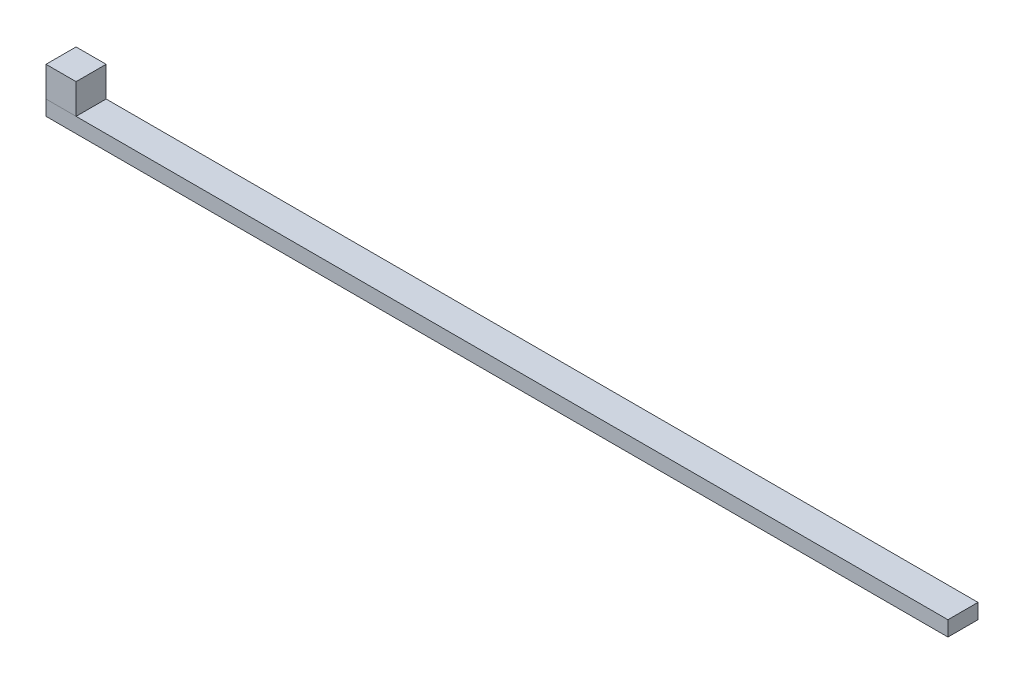
from build123d import *

# Parameters (mm, degrees)
EXTRUDE_1_DEPTH = 100
SKETCH_1_3_W    = 100
SKETCH_1_3_H    = 100
EXTRUDE_2_DEPTH = 100


with BuildPart() as part:
    # ｽｹｯﾁ1 → ﾎﾞｽ - 押し出し1 (new body)
    with BuildSketch(Plane.XY):
        Polygon((100, 0), (0, 0), (0, -50), (3000, -50), (3000, 0), align=None)
    extrude(amount=EXTRUDE_1_DEPTH)


with BuildPart() as body_2:
    # ｽｹｯﾁ1<3> → ﾎﾞｽ - 押し出し2 (new body)
    with BuildSketch(Plane.XY):
        with Locations((50, 50)):
            Rectangle(SKETCH_1_3_W, SKETCH_1_3_H)
    extrude(amount=EXTRUDE_2_DEPTH)


solid = Compound([part.part, body_2.part])
